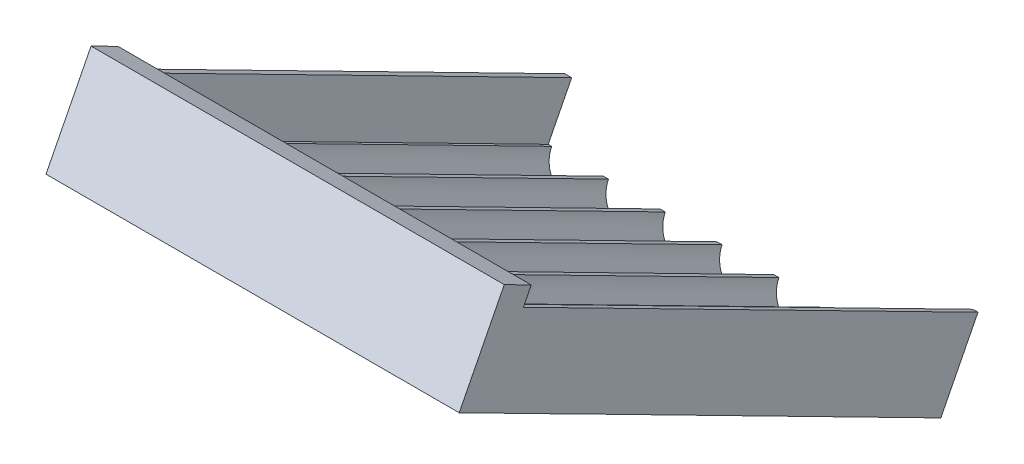
from build123d import *

# Parameters (mm, degrees)
BOSS_EXTRUDE1_DEPTH = 1200
CUT_EXTRUDE1_DEPTH  = 1200
BOSS_EXTRUDE2_DEPTH = 20
BOSS_EXTRUDE6_DEPTH = 15


with BuildPart() as part:
    # Sketch1 → Boss-Extrude1 (new body)
    with BuildSketch(Plane(origin=(0, 0, 0), x_dir=(0, 0, -1), z_dir=(1, 0, 0))):
        Polygon((54.714181984, -127.878268169), (0, -100), (-196.261050551, 0), (-105.357341624, 178.408574129), (-183.765915753, 218.359738106), (-314.620788656, -38.457410151), (-39.951163977, -178.408574129), (54.714181984, -226.346681732), (1084.090701019, -750.840215293), (1123.92201101, -672.666867856), align=None)
    extrude(amount=BOSS_EXTRUDE1_DEPTH)

    # Sketch2 → Cut-Extrude1 (cut)
    with BuildSketch(Plane(origin=(0, -593.277605242, -1164.372860728), x_dir=(-1, 0, 0), z_dir=(0, -0.45399049973954697, -0.8910065241883679))):
        with BuildLine():
            ThreePointArc((-1076.711357012, -161.83665133), (-1035.853367703, -135.21654868), (-1020, -89.100652419))
            Line((-1020, -89.100652419), (-1170, -89.100652419))
            ThreePointArc((-1170, -89.100652419), (-1154.146632297, -135.21654868), (-1113.288642988, -161.83665133))
            Line((-1113.288642988, -161.83665133), (-1113.288642988, -176.83665133))
            Line((-1113.288642988, -176.83665133), (-1076.711357012, -176.83665133))
            Line((-1076.711357012, -176.83665133), (-1076.711357012, -161.83665133))
        make_face()
        with BuildLine():
            ThreePointArc((-911.711357012, -161.83665133), (-870.853367703, -135.21654868), (-855, -89.100652419))
            Line((-855, -89.100652419), (-1005, -89.100652419))
            ThreePointArc((-1005, -89.100652419), (-989.146632297, -135.21654868), (-948.288642988, -161.83665133))
            Line((-948.288642988, -161.83665133), (-948.288642988, -176.83665133))
            Line((-948.288642988, -176.83665133), (-911.711357012, -176.83665133))
            Line((-911.711357012, -176.83665133), (-911.711357012, -161.83665133))
        make_face()
        with BuildLine():
            ThreePointArc((-746.711357012, -161.83665133), (-705.853367703, -135.21654868), (-690, -89.100652419))
            Line((-690, -89.100652419), (-840, -89.100652419))
            ThreePointArc((-840, -89.100652419), (-824.146632297, -135.21654868), (-783.288642988, -161.83665133))
            Line((-783.288642988, -161.83665133), (-783.288642988, -176.83665133))
            Line((-783.288642988, -176.83665133), (-746.711357012, -176.83665133))
            Line((-746.711357012, -176.83665133), (-746.711357012, -161.83665133))
        make_face()
        with BuildLine():
            Line((-525, -89.100652419), (-675, -89.100652419))
            ThreePointArc((-675, -89.100652419), (-659.146632297, -135.21654868), (-618.288642988, -161.83665133))
            Line((-618.288642988, -161.83665133), (-618.288642988, -176.83665133))
            Line((-618.288642988, -176.83665133), (-581.711357012, -176.83665133))
            Line((-581.711357012, -176.83665133), (-581.711357012, -161.83665133))
            ThreePointArc((-581.711357012, -161.83665133), (-540.853367703, -135.21654868), (-525, -89.100652419))
        make_face()
        with BuildLine():
            Line((-360, -89.100652419), (-510, -89.100652419))
            ThreePointArc((-510, -89.100652419), (-494.146632297, -135.21654868), (-453.288642988, -161.83665133))
            Line((-453.288642988, -161.83665133), (-453.288642988, -176.83665133))
            Line((-453.288642988, -176.83665133), (-416.711357012, -176.83665133))
            Line((-416.711357012, -176.83665133), (-416.711357012, -161.83665133))
            ThreePointArc((-416.711357012, -161.83665133), (-375.853367703, -135.21654868), (-360, -89.100652419))
        make_face()
        with BuildLine():
            Line((-195, -89.100652419), (-345, -89.100652419))
            ThreePointArc((-345, -89.100652419), (-329.146632297, -135.21654868), (-288.288642988, -161.83665133))
            Line((-288.288642988, -161.83665133), (-288.288642988, -176.83665133))
            Line((-288.288642988, -176.83665133), (-251.711357012, -176.83665133))
            Line((-251.711357012, -176.83665133), (-251.711357012, -161.83665133))
            ThreePointArc((-251.711357012, -161.83665133), (-210.853367703, -135.21654868), (-195, -89.100652419))
        make_face()
        with BuildLine():
            Line((-30, -89.100652419), (-180, -89.100652419))
            ThreePointArc((-180, -89.100652419), (-164.146632297, -135.21654868), (-123.288642988, -161.83665133))
            Line((-123.288642988, -161.83665133), (-123.288642988, -176.83665133))
            Line((-123.288642988, -176.83665133), (-86.711357012, -176.83665133))
            Line((-86.711357012, -176.83665133), (-86.711357012, -161.83665133))
            ThreePointArc((-86.711357012, -161.83665133), (-45.853367703, -135.21654868), (-30, -89.100652419))
        make_face()
    extrude(amount=-CUT_EXTRUDE1_DEPTH, mode=Mode.SUBTRACT)

    # Sketch4 → Boss-Extrude2 (add)
    with BuildSketch(Plane.ZY):
        Polygon((196.261050551, 0), (128.16247559, 133.650978628), (-1192.020585971, -539.015889228), (-1123.92201101, -672.666867856), align=None)
    extrude(amount=-BOSS_EXTRUDE2_DEPTH)

    # Sketch14 → Boss-Extrude6 (add)
    with BuildSketch(Plane(origin=(1200, 0, 0), x_dir=(0, 0, -1), z_dir=(1, 0, 0))):
        Polygon((-196.261050551, 0), (-128.16247559, 133.650978628), (1192.020585971, -539.015889228), (1123.92201101, -672.666867856), align=None)
    extrude(amount=-BOSS_EXTRUDE6_DEPTH)


solid = part.part
